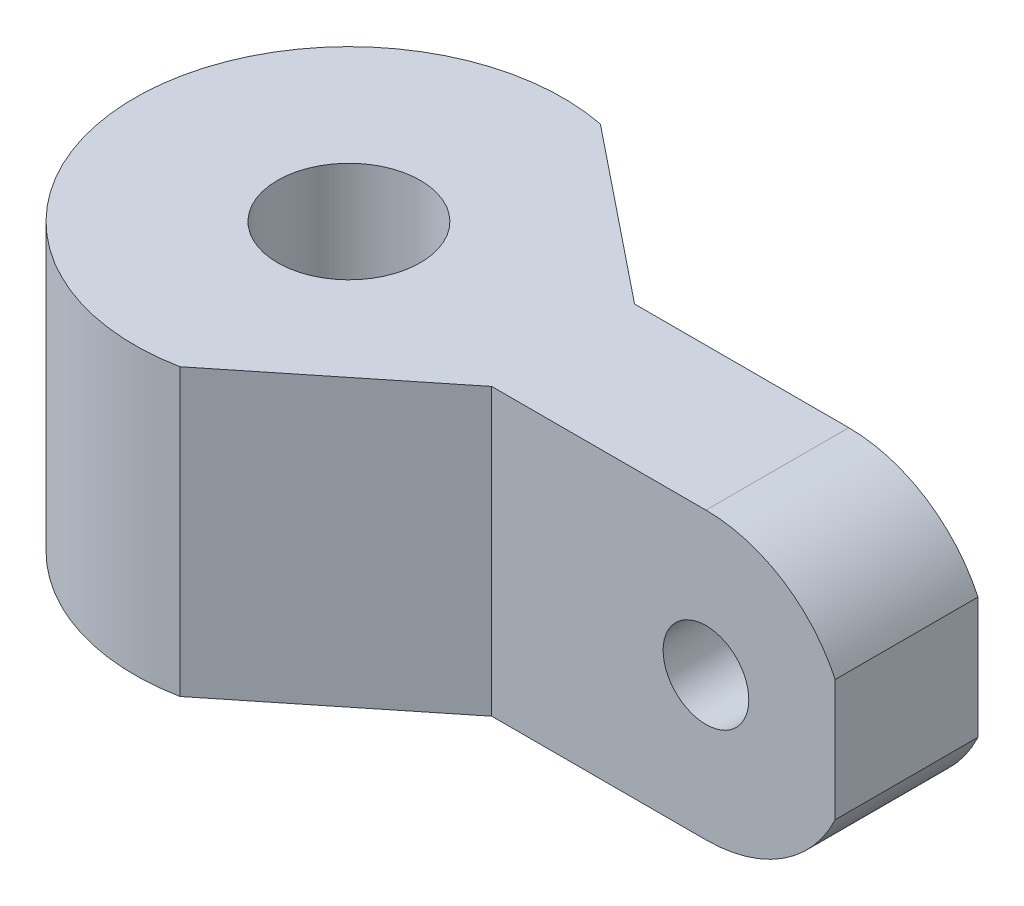
from build123d import *

# Parameters (mm, degrees)
CROQUIS1_W              = 25
CROQUIS1_H              = 10
CROQUIS1_R              = 1.5
SALIENTE_EXTRUIR1_DEPTH = 10
CROQUIS2_R              = 2.5
CORTAR_EXTRUIR1_DEPTH   = 14
CROQUIS3_OUTSIDE_W      = 17.744
CROQUIS3_OUTSIDE_H      = 17.744
CROQUIS3_OUTSIDE_W_2    = 5
CROQUIS3_OUTSIDE_H_2    = 10
CORTAR_EXTRUIR2_DEPTH   = 12.5
CUT_EXTRUDE1_DEPTH      = 10
CROQUIS5_R              = 2.5
SALIENTE_EXTRUIR5_DEPTH = 10
CORTAR_EXTRUIR3_DEPTH   = 28.613402543


with BuildPart() as part:
    # Croquis1 → Saliente-Extruir1 (new body)
    with BuildSketch(Plane.XY):
        with Locations((-7.5, 0)):
            Rectangle(CROQUIS1_W, CROQUIS1_H)
        Circle(CROQUIS1_R, mode=Mode.SUBTRACT)
    extrude(amount=SALIENTE_EXTRUIR1_DEPTH)

    # Croquis2 → Cortar-Extruir1 (cut)
    with BuildSketch(Plane(origin=(0, 5, 0), x_dir=(1, 0, 0), z_dir=(0, 1, 0))):
        with Locations(Location((-15, -5, 0), (0, 0, 180))):
            Circle(CROQUIS2_R)
    extrude(amount=-CORTAR_EXTRUIR1_DEPTH, mode=Mode.SUBTRACT)

    # Croquis3 outside → Cortar-Extruir2 (cut)
    with BuildSketch(Plane(origin=(5, 0, 0), x_dir=(0, 0, -1), z_dir=(1, 0, 0))):
        with Locations((-5, 0)):
            Rectangle(CROQUIS3_OUTSIDE_W, CROQUIS3_OUTSIDE_H)
        with Locations((-5, 0)):
            Rectangle(CROQUIS3_OUTSIDE_W_2, CROQUIS3_OUTSIDE_H_2, mode=Mode.SUBTRACT)
    extrude(amount=-CORTAR_EXTRUIR2_DEPTH, mode=Mode.SUBTRACT)

    # Sketch1 → Cut-Extrude1 (cut)
    with BuildSketch(Plane.XY.offset(10)):
        with BuildLine():
            Line((0, 5), (5.992915048, 5))
            Line((5.992915048, 5), (5.992915048, -6.748814934))
            Line((5.992915048, -6.748814934), (0, -5))
            ThreePointArc((0, -5), (2.680080756, -4.221038633), (4.525089765, -2.126866856))
            Line((4.525089765, -2.126866856), (4.525089765, 2.126866856))
            ThreePointArc((4.525089765, 2.126866856), (2.680080756, 4.221038633), (0, 5))
        make_face()
    extrude(amount=-CUT_EXTRUDE1_DEPTH, mode=Mode.SUBTRACT)

    # Croquis5 → Saliente-Extruir5 (add)
    with BuildSketch(Plane(origin=(0, 5, 0), x_dir=(1, 0, 0), z_dir=(0, 1, 0))):
        with BuildLine():
            Line((-12.115384615, 1.923076923), (-7.5, 0))
            Line((-7.5, 0), (-7.5, -10))
            Line((-7.5, -10), (-11.574224798, -11.67188611))
            ThreePointArc((-11.574224798, -11.67188611), (-22.494065139, -5.298308051), (-12.115384615, 1.923076923))
        make_face()
        with Locations(Location((-15, -5, 0), (0, 0, 180))):
            Circle(CROQUIS5_R, mode=Mode.SUBTRACT)
    extrude(amount=-SALIENTE_EXTRUIR5_DEPTH)

    # Croquis6 → Cortar-Extruir3 (cut, through all)
    with BuildSketch(Plane(origin=(0, 5, 0), x_dir=(1, 0, 0), z_dir=(0, 1, 0))):
        Polygon((-13.556059362, 2.359689901), (-7.5, -2.5), (-7.5, 2.359689901), align=None)
        Polygon((-7.5, -7.5), (-7.5, -12.359689901), (-13.556059362, -12.359689901), align=None)
    extrude(amount=-CORTAR_EXTRUIR3_DEPTH, mode=Mode.SUBTRACT)


solid = part.part
